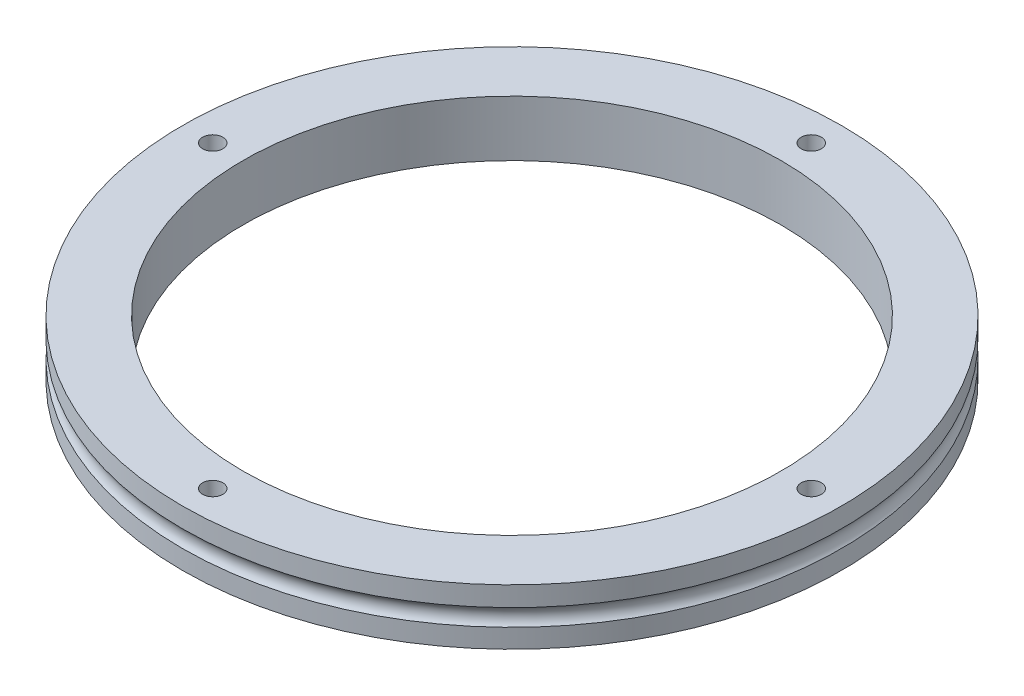
from build123d import *

# Parameters (mm, degrees)
SKETCH_7_R          = 40
CUT_EXTRUDE_1_DEPTH = 73.864118401
SKETCH_8_R          = 1.5
CUT_EXTRUDE_2_DEPTH = 10


with BuildPart() as part:
    # 草图5 → 旋转2 (revolve)
    with BuildSketch(Plane.XY, mode=Mode.PRIVATE) as revolve_2_sk:
        with BuildLine():
            Line((-46.752169664, 16.788080184), (2.247830336, 16.788080184))
            Line((2.247830336, 16.788080184), (2.247830336, 8.488080184))
            Line((2.247830336, 8.488080184), (-46.752169664, 8.488080184))
            Line((-46.752169664, 8.488080184), (-46.752169664, 11.319510864))
            ThreePointArc((-46.752169664, 11.319510864), (-46.381680312, 11.906305273), (-46.252169664, 12.588080184))
            ThreePointArc((-46.252169664, 12.588080184), (-46.381680312, 13.269855096), (-46.752169664, 13.856649505))
            Line((-46.752169664, 13.856649505), (-46.752169664, 16.788080184))
        make_face()
    revolve(revolve_2_sk.sketch.rotate(Axis((2.247830336, 16.788080184, 0), (0, -1, 0)), 270), axis=Axis((2.247830336, 16.788080184, 0), (0, -1, 0)))

    # 草图7 → 切除-拉伸1 (cut, through all)
    with BuildSketch(Plane(origin=(0, 0, 0), x_dir=(1, 0, 0), z_dir=(0, 1, 0))):
        with Locations(Location((2.247830336, 0, 0), (0, 0, 90))):
            Circle(SKETCH_7_R)
    extrude(amount=CUT_EXTRUDE_1_DEPTH, mode=Mode.SUBTRACT)

    # 草图8 → 切除-拉伸2 (cut)
    with BuildSketch(Plane(origin=(0, 16.788080184, 0), x_dir=(1, 0, 0), z_dir=(0, 1, 0))):
        with Locations(Location((2.247830336, 44.5, 0), (0, 0, 270))):
            Circle(SKETCH_8_R)
        with Locations(Location((46.747830336, 0, 0), (0, 0, 270))):
            Circle(SKETCH_8_R)
        with Locations(Location((2.247830336, -44.5, 0), (0, 0, 270))):
            Circle(SKETCH_8_R)
        with Locations(Location((-42.252169664, 0, 0), (0, 0, 270))):
            Circle(SKETCH_8_R)
    extrude(amount=-CUT_EXTRUDE_2_DEPTH, mode=Mode.SUBTRACT)


solid = part.part
